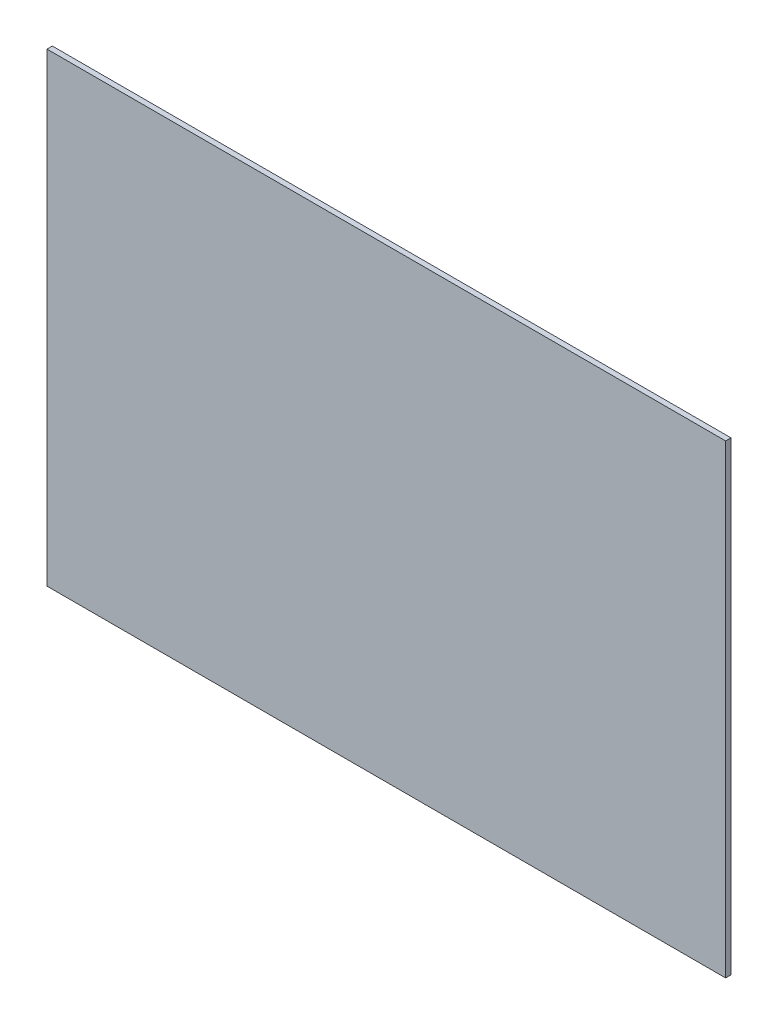
from build123d import *

# Parameters (mm, degrees)
SKETCH4_W           = 322.834
SKETCH4_H           = 221.234
BOSS_EXTRUDE4_DEPTH = 2.54


with BuildPart() as part:
    # Sketch4 → Boss-Extrude4 (new body)
    with BuildSketch(Plane.XY):
        with Locations((36.542483925, -79.149488066)):
            Rectangle(SKETCH4_W, SKETCH4_H)
    extrude(amount=BOSS_EXTRUDE4_DEPTH)


solid = part.part
